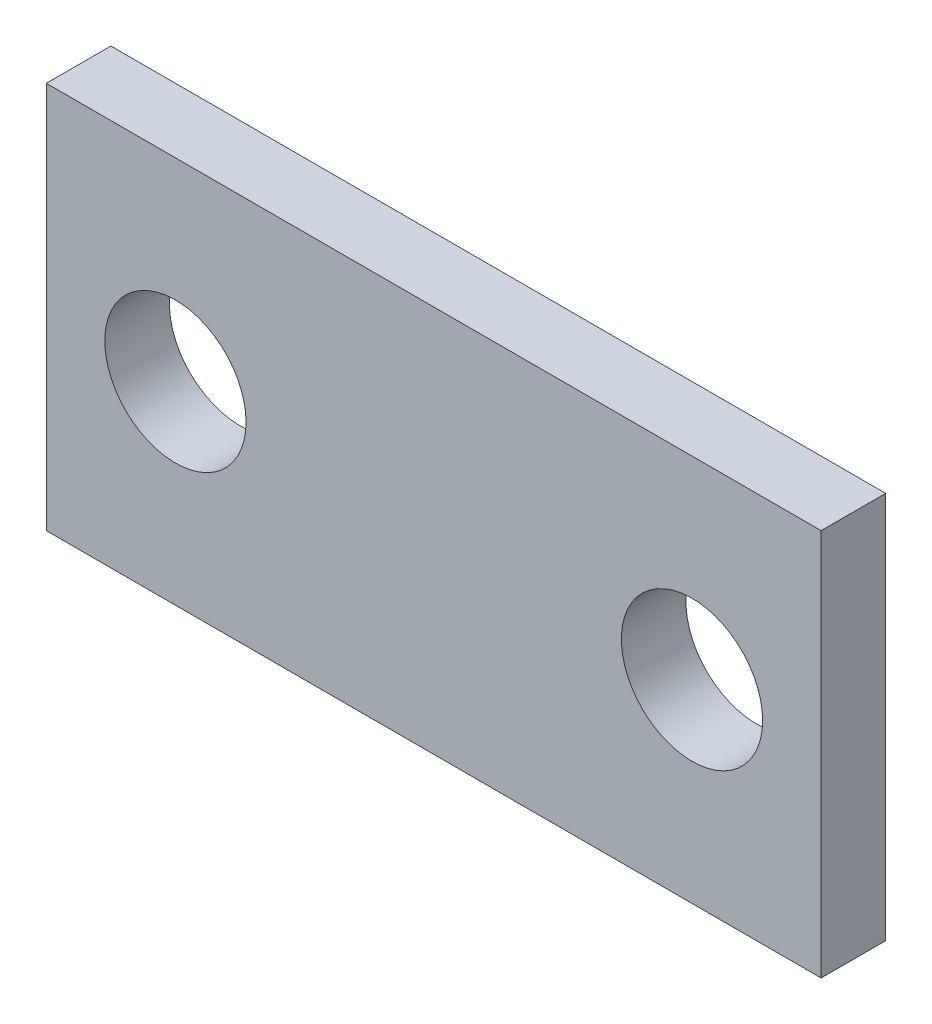
from build123d import *

# Parameters (mm, degrees)
SKETCH1_W                   = 76.2
SKETCH1_H                   = 38.1
EXTRUDE1_DEPTH              = 6.35
F_1_2_CLEARANCE_HOLE1_D     = 13.89126
F_1_2_CLEARANCE_HOLE1_DEPTH = 6.35
F_1_2_CLEARANCE_HOLE1_TIP   = 4.173355541


with BuildPart() as part:
    # Sketch1 → Extrude1 (new body)
    with BuildSketch(Plane.XY):
        Rectangle(SKETCH1_W, SKETCH1_H)
    extrude(amount=-EXTRUDE1_DEPTH)

    # 1/2 Clearance Hole1
    with Locations(Plane.XY):
        with Locations((-25.4, 0), (25.4, 0)):
            Hole(F_1_2_CLEARANCE_HOLE1_D / 2, depth=F_1_2_CLEARANCE_HOLE1_DEPTH)
            with Locations((0, 0, -(F_1_2_CLEARANCE_HOLE1_DEPTH + F_1_2_CLEARANCE_HOLE1_TIP / 2))):  # 118° drill point
                Cone(0, F_1_2_CLEARANCE_HOLE1_D / 2, F_1_2_CLEARANCE_HOLE1_TIP, mode=Mode.SUBTRACT)


solid = part.part
